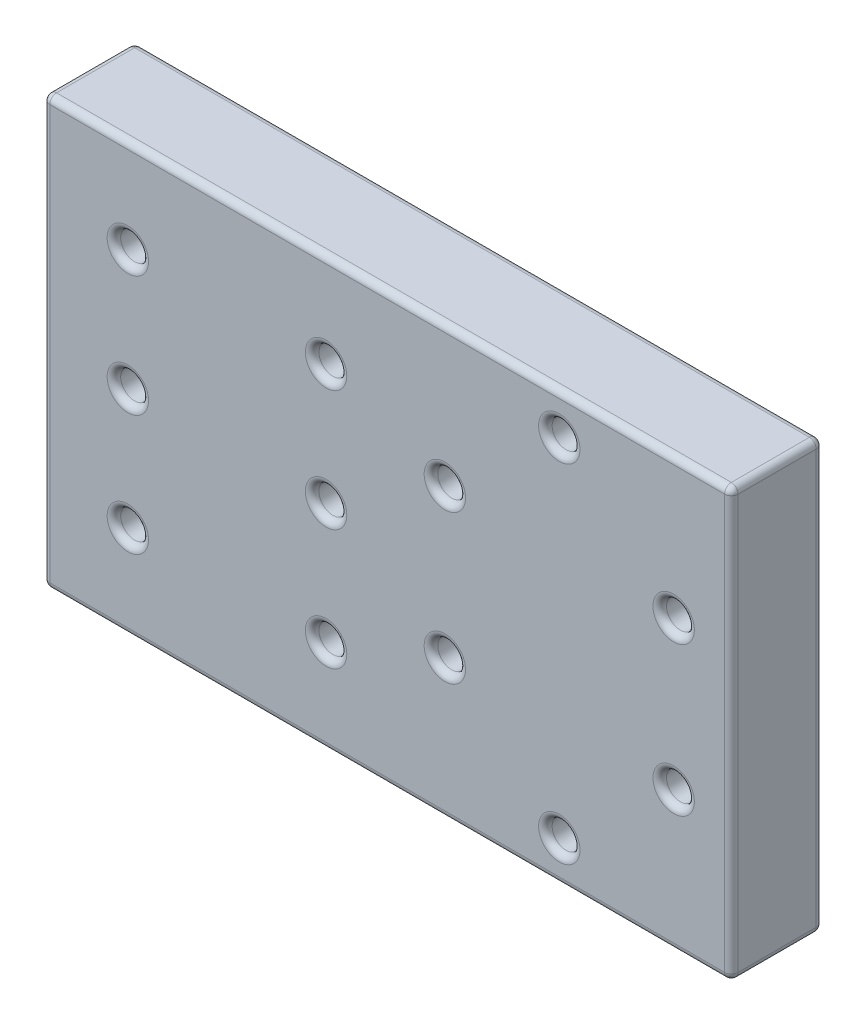
from build123d import *

# Parameters (mm, degrees)
SKETCH_1_W          = 101.4
SKETCH_1_H          = 63
EXTRUDE_1_DEPTH     = 13.5
SKETCH_2_R          = 2.05
CUT_EXTRUDE_1_DEPTH = 13.5
FILLET_1_R          = 1


with BuildPart() as part:
    # 스케치1 → 보스-돌출1 (new body)
    with BuildSketch(Plane.XY):
        Rectangle(SKETCH_1_W, SKETCH_1_H)
    extrude(amount=EXTRUDE_1_DEPTH)

    # 스케치2 → 컷-돌출1 (cut)
    with BuildSketch(Plane.XY.offset(13.5)):
        with Locations((-38.2, 17.75)):
            Circle(SKETCH_2_R)
        with Locations((-38.2, 0)):
            Circle(SKETCH_2_R)
        with Locations((-38.2, -17.75)):
            Circle(SKETCH_2_R)
        with Locations((-9, 17.75)):
            Circle(SKETCH_2_R)
        with Locations((-9, 0)):
            Circle(SKETCH_2_R)
        with Locations((-9, -17.75)):
            Circle(SKETCH_2_R)
        with Locations((25.35, 25.55)):
            Circle(SKETCH_2_R)
        with Locations((8.5, 10.95)):
            Circle(SKETCH_2_R)
        with Locations((8.5, -10.95)):
            Circle(SKETCH_2_R)
        with Locations((42.2, 10.95)):
            Circle(SKETCH_2_R)
        with Locations((42.2, -10.95)):
            Circle(SKETCH_2_R)
        with Locations((25.35, -25.55)):
            Circle(SKETCH_2_R)
    extrude(amount=-CUT_EXTRUDE_1_DEPTH, mode=Mode.SUBTRACT)

    # 필렛1
    fillet_1_edges = [part.edges().sort_by_distance(p)[0] for p in [
        (50.7, 0, 13.5),
        (0, 31.5, 13.5),
        (-40.25, 17.75, 0),
        (-40.25, 17.75, 13.5),
        (-40.25, 0, 0),
        (-40.25, 0, 13.5),
        (-40.25, -17.75, 0),
        (-40.25, -17.75, 13.5),
        (-11.05, 17.75, 0),
        (-11.05, 17.75, 13.5),
        (-11.05, 0, 0),
        (-11.05, 0, 13.5),
        (-11.05, -17.75, 0),
        (-11.05, -17.75, 13.5),
        (23.3, -25.55, 0),
        (23.3, -25.55, 13.5),
        (-50.7, 0, 13.5),
        (40.15, -10.95, 0),
        (40.15, -10.95, 13.5),
        (40.15, 10.95, 0),
        (40.15, 10.95, 13.5),
        (6.45, -10.95, 0),
        (0, 31.5, 0),
        (6.45, -10.95, 13.5),
        (6.45, 10.95, 0),
        (6.45, 10.95, 13.5),
        (23.3, 25.55, 0),
        (23.3, 25.55, 13.5),
        (50.7, 0, 0),
        (0, -31.5, 0),
        (-50.7, 0, 0),
        (0, -31.5, 13.5),
        (-50.7, 31.5, 6.75),
        (50.7, 31.5, 6.75),
        (50.7, -31.5, 6.75),
        (-50.7, -31.5, 6.75),
    ]]
    fillet(fillet_1_edges, radius=FILLET_1_R)


solid = part.part
